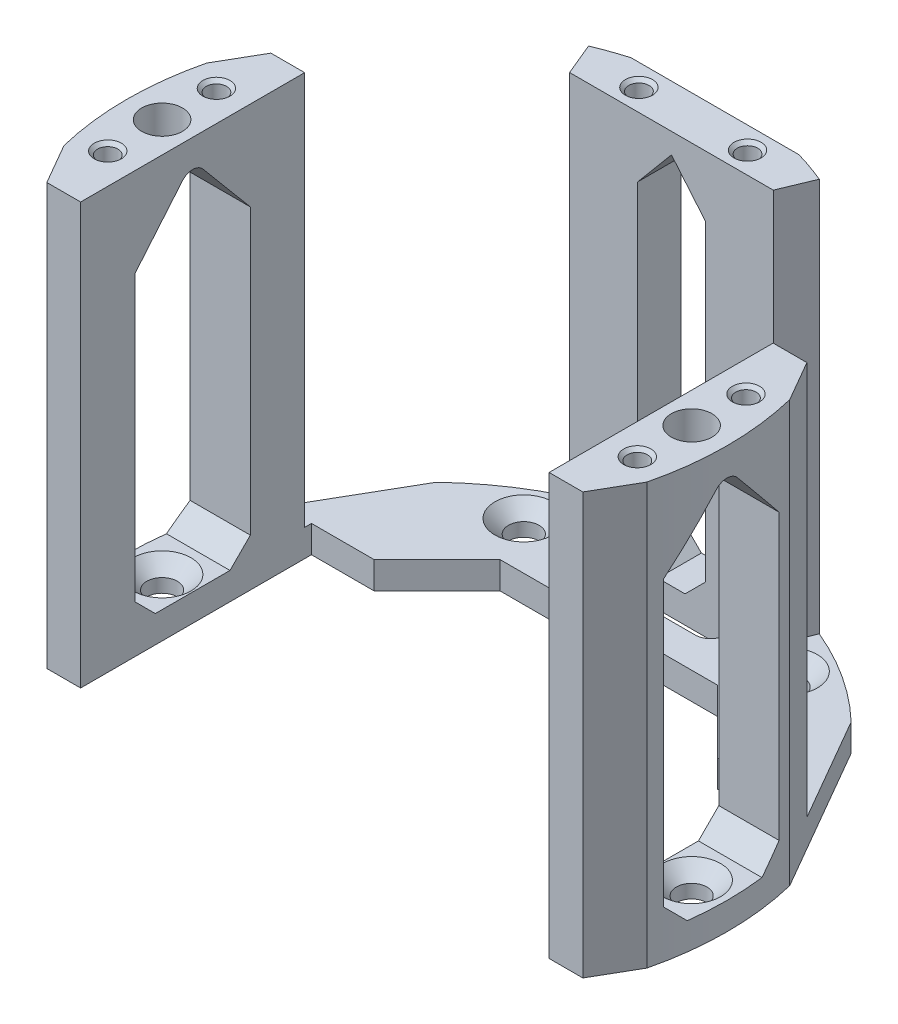
from build123d import *

# Parameters (mm, degrees)
SKETCH_1_R           = 2.250000000000002
SKETCH_1_R_2         = 2.2500000000000027
EXTRUDE_1_DEPTH      = 4
EXTRUDE_2_DEPTH      = 58
EXTRUDE_3_REACH      = 110.805
EXTRUDE_3_END_RADIUS = 44.19999999999999
CUT_EXTRUDE_1_REACH  = 89.17
SKETCH_4_R           = 3.0000000000000013
FILLET_1_R           = 2
CHAMFER_1_SIZE       = 2
EXTRUDE_4_DEPTH      = 58
EXTRUDE_5_DEPTH      = 6.412205295
SKETCH_8_R           = 1.5000000000000042
SKETCH_8_R_2         = 1.5000000000000009
SKETCH_8_R_3         = 1.500000000000004
SKETCH_8_R_4         = 1.500000000000017
SKETCH_8_R_5         = 1.5000000000000173
CUT_EXTRUDE_2_DEPTH  = 5
CHAMFER_2_SIZE       = 0.5
CHAMFER_3_SIZE       = 3


with BuildPart() as part:
    # Эскиз1 → Бобышка-Вытянуть1 (new body)
    with BuildSketch(Plane(origin=(0, 0, 0), x_dir=(1, 0, 0), z_dir=(0, 1, 0))):
        with BuildLine():
            Line((-42.93077537059159, -10.516107934012744), (-39.47597367549217, -16.5))
            Line((-39.47597367549216, -16.5), (-34.49999999999999, -16.5))
            Line((-34.49999999999999, -16.5), (-34.49999999999999, -3.5000000000000013))
            Line((-34.49999999999999, -3.5000000000000013), (-34.49999999999999, 3.5000000000000013))
            Line((-34.49999999999999, 3.5000000000000018), (-34.49999999999999, 17.5))
            Line((-34.49999999999999, 17.5), (-25.274990747593094, 17.499999999999996))
            Line((-25.274990747593094, 17.499999999999996), (-16, 26.77499074759315))
            Line((-16, 26.77499074759315), (16, 26.77499074759315))
            Line((16, 26.77499074759315), (25.274990747593094, 17.499999999999996))
            Line((25.274990747593094, 17.499999999999996), (34.50000000000001, 17.5))
            Line((34.50000000000001, 17.5), (34.50000000000001, 3.5000000000000013))
            Line((34.50000000000001, 3.5000000000000013), (34.5, -3.5000000000000013))
            Line((34.5, -3.5000000000000018), (34.5, -16.5))
            Line((34.5, -16.5), (39.475973675492156, -16.5))
            Line((39.475973675492156, -16.5), (42.9307753705916, -10.516107934012684))
            ThreePointArc((42.93077537059159, -10.516107934012682), (44.199999999999974, 1.599e-14), (42.93077537059159, 10.516107934012718))
            Line((42.93077537059159, 10.516107934012716), (30.572604305089854, 31.92108810808932))
            ThreePointArc((30.57260430508986, 31.92108810808933), (22.099999999999994, 38.27832284727222), (12.358171065501741, 42.43719604210199))
            Line((12.358171065501741, 42.437196042101974), (-12.358171065501741, 42.437196042101974))
            ThreePointArc((-12.358171065501743, 42.43719604210198), (-22.099999999999994, 38.278322847272186), (-30.572604305089868, 31.921088108089307))
            Line((-30.572604305089865, 31.9210881080893), (-42.930775370591604, 10.5161079340127))
            ThreePointArc((-42.930775370591604, 10.516107934012702), (-44.19999999999999, -1.954e-14), (-42.93077537059159, -10.516107934012746))
        make_face()
        with Locations(Location((-39, 0, 0), (0, 0, 270))):
            Circle(SKETCH_1_R, mode=Mode.SUBTRACT)
        with Locations(Location((39, 0, 0), (0, 0, 270))):
            Circle(SKETCH_1_R, mode=Mode.SUBTRACT)
        with Locations(Location((-19.50000000000016, 33.77499074759302, 0), (0, 0, 270))):
            Circle(SKETCH_1_R_2, mode=Mode.SUBTRACT)
        with BuildLine():
            Line((-8, 36.024990747593144), (8, 36.024990747593144))
            ThreePointArc((8, 36.024990747593144), (10.25, 33.774990747593144), (7.999999999999998, 31.524990747593144))
            Line((7.999999999999998, 31.524990747593144), (-7.999999999999998, 31.524990747593144))
            ThreePointArc((-7.999999999999998, 31.524990747593144), (-10.25, 33.774990747593144), (-8, 36.024990747593144))
        make_face(mode=Mode.SUBTRACT)
        with Locations(Location((19.499999999999925, 33.77499074759315, 0), (0, 0, 270))):
            Circle(SKETCH_1_R_2, mode=Mode.SUBTRACT)
    extrude(amount=EXTRUDE_1_DEPTH)

    # Эскиз2 → Бобышка-Вытянуть2 (add)
    with BuildSketch(Plane(origin=(0, 4, 0), x_dir=(1, 0, 0), z_dir=(0, 1, 0))):
        with BuildLine():
            ThreePointArc((-42.9307753705916, 10.516107934012743), (-43.16465657781108, 9.51064784962775), (-43.37499279538843, 8.50000000000001))
            Line((-43.37499279538844, 8.50000000000001), (-34.499999999999986, 8.500000000000005))
            Line((-34.499999999999986, 8.500000000000005), (-34.49999999999999, 16.5))
            Line((-34.49999999999999, 16.5), (-39.47597367549217, 16.5))
            Line((-39.47597367549217, 16.5), (-42.9307753705916, 10.516107934012743))
        make_face()
        with BuildLine():
            Line((-34.499999999999986, -8.500000000000005), (-43.37499279538844, -8.50000000000001))
            ThreePointArc((-43.37499279538843, -8.50000000000001), (-43.16465657781108, -9.51064784962775), (-42.9307753705916, -10.516107934012743))
            Line((-42.9307753705916, -10.516107934012743), (-39.47597367549217, -16.5))
            Line((-39.47597367549217, -16.5), (-34.49999999999999, -16.5))
            Line((-34.49999999999999, -16.5), (-34.499999999999986, -8.500000000000005))
        make_face()
        with BuildLine():
            Line((34.499999999999986, 8.500000000000005), (43.37499279538844, 8.50000000000001))
            ThreePointArc((43.37499279538845, 8.50000000000001), (43.16465657781109, 9.510647849627738), (42.930775370591604, 10.51610793401272))
            Line((42.930775370591604, 10.516107934012684), (39.475973675492156, 16.5))
            Line((39.475973675492156, 16.5), (34.5, 16.5))
            Line((34.5, 16.5), (34.499999999999986, 8.500000000000005))
        make_face()
        with BuildLine():
            ThreePointArc((42.93077537059162, -10.516107934012688), (43.164656577811115, -9.510647849627723), (43.37499279538845, -8.50000000000001))
            Line((43.37499279538844, -8.50000000000001), (34.499999999999986, -8.500000000000005))
            Line((34.499999999999986, -8.500000000000005), (34.5, -16.5))
            Line((34.5, -16.5), (39.475973675492156, -16.5))
            Line((39.475973675492156, -16.5), (42.930775370591604, -10.516107934012684))
        make_face()
    extrude(amount=EXTRUDE_2_DEPTH)

    # Бобышка-Вытянуть3: up to this cylinder (the profile starts inside it)
    extrude_3_end = Plane(origin=(0, 61.785199, 0), z_dir=(0, -1, 0)) * Cylinder(EXTRUDE_3_END_RADIUS, 311.01, mode=Mode.PRIVATE)
    # Эскиз3 → Бобышка-Вытянуть3 (add, up to the surface)
    with BuildSketch(Plane(origin=(-34.49999999999999, 0, 0), x_dir=(0, 0, -1), z_dir=(1, 0, 0)), mode=Mode.PRIVATE) as extrude_3_sk1:
        Polygon((-8.500000000000007, 62.00000000000001), (8.500000000000005, 62.00000000000001), (8.500000000000005, 48.87009446294909), (0, 59.00000000000001), (-8.500000000000005, 48.87009446294909), align=None)
    extrude_3_tool1 = extrude(extrude_3_sk1.sketch, amount=-EXTRUDE_3_REACH, mode=Mode.PRIVATE) & extrude_3_end
    extrude_3 = extrude_3_tool1.solids().sort_by_distance((-34.5, 61.785199, 0))[0]
    add(extrude_3)

    # Зеркальное отражение1: Бобышка-Вытянуть3 across plane
    add(extrude_3.mirror(Plane(origin=(0, 0, 0), x_dir=(0, 0, 1), z_dir=(1, 0, 0))))

    # Вырез-Вытянуть1: up to this face of the body (flat: up to its plane)
    cut_extrude_1_end = Plane(part.part.faces().sort_by_distance((44.00427315, 4, 0))[0])
    # Эскиз4 → Вырез-Вытянуть1 (cut, up to the picked face)
    with BuildSketch(Plane(origin=(0, 62.00000000000001, 0), x_dir=(1, 0, 0), z_dir=(0, 1, 0)), mode=Mode.PRIVATE) as cut_extrude_1_sk1:
        with Locations(Location((-39, 0, 0), (0, 0, 270))):
            Circle(SKETCH_4_R)
    cut_extrude_1_tool1 = split(extrude(cut_extrude_1_sk1.sketch, amount=-CUT_EXTRUDE_1_REACH, mode=Mode.PRIVATE), bisect_by=cut_extrude_1_end, keep=Keep.BOTH, mode=Mode.PRIVATE)
    # Эскиз4 → Вырез-Вытянуть1 (cut, up to the picked face)
    with BuildSketch(Plane(origin=(0, 62.00000000000001, 0), x_dir=(1, 0, 0), z_dir=(0, 1, 0)), mode=Mode.PRIVATE) as cut_extrude_1_sk2:
        with Locations(Location((39, 0, 0), (0, 0, 270))):
            Circle(SKETCH_4_R)
    cut_extrude_1_tool2 = split(extrude(cut_extrude_1_sk2.sketch, amount=-CUT_EXTRUDE_1_REACH, mode=Mode.PRIVATE), bisect_by=cut_extrude_1_end, keep=Keep.BOTH, mode=Mode.PRIVATE)
    add(cut_extrude_1_tool1.solids().sort_by(Axis((-39, 62, 0), (0, -1, 0)))[0], mode=Mode.SUBTRACT)
    add(cut_extrude_1_tool2.solids().sort_by(Axis((39, 62, 0), (0, -1, 0)))[0], mode=Mode.SUBTRACT)

    # Скругление1
    fillet_1_edges = [part.edges().sort_by_distance(p)[0] for p in [
        (35.249999999999986, 59.00000000000001, 0),
        (43.1, 59.00000000000001, 0),
        (-43.1, 59.00000000000001, 0),
        (-35.249999999999986, 59.00000000000001, 0),
    ]]
    fillet(fillet_1_edges, radius=FILLET_1_R)

    # Фаска1
    chamfer_1_edges = [part.edges().sort_by_distance(p)[0] for p in [
        (-19.50000000000016, 4, -36.02499074759302),
        (19.499999999999925, 4, -36.02499074759315),
        (39, 4, -2.250000000000002),
        (-39, 4, -2.250000000000002),
    ]]
    chamfer(chamfer_1_edges, length=CHAMFER_1_SIZE)

    # Эскиз6 → Бобышка-Вытянуть4 (add)
    with BuildSketch(Plane(origin=(0, 4, 0), x_dir=(1, 0, 0), z_dir=(0, 1, 0))):
        with BuildLine():
            Line((8, 36.024990747593144), (5.000000000000001, 36.024990747593144))
            Line((5.000000000000001, 36.024990747593144), (5, 42.437196042101974))
            Line((5, 42.437196042101974), (12.358171065501741, 42.437196042101974))
            ThreePointArc((12.358171065501741, 42.437196042101974), (14.696759256079767, 41.68507247647332), (16.989949980131733, 40.8041860557544))
            Line((16.989949980131733, 40.8041860557544), (15, 36.02499074759314))
            Line((15, 36.02499074759314), (8, 36.024990747593144))
        make_face()
        with BuildLine():
            Line((-12.358171065501741, 42.437196042101974), (-5, 42.437196042101974))
            Line((-5, 42.437196042101974), (-5.000000000000001, 36.024990747593144))
            Line((-5.000000000000001, 36.024990747593144), (-8, 36.024990747593144))
            Line((-8, 36.024990747593144), (-15, 36.02499074759314))
            Line((-15, 36.02499074759314), (-16.989949980131733, 40.8041860557544))
            ThreePointArc((-16.989949980131733, 40.8041860557544), (-14.696759256079767, 41.685072476473316), (-12.358171065501741, 42.437196042101974))
        make_face()
    extrude(amount=EXTRUDE_4_DEPTH)

    # Эскиз7 → Бобышка-Вытянуть5 (add)
    with BuildSketch(Plane.XY.offset(-36.024990747593144)):
        Polygon((-5.000000000000001, 62.00000000000001), (-5, 53.04123203702888), (0, 59.00000000000001), (5.000000000000003, 53.04123203702888), (5.000000000000001, 62.00000000000001), align=None)
    extrude(amount=-EXTRUDE_5_DEPTH)

    # Эскиз8 → Вырез-Вытянуть2 (cut)
    with BuildSketch(Plane(origin=(0, 62.00000000000001, 0), x_dir=(1, 0, 0), z_dir=(0, 1, 0))):
        with Locations(Location((38.99999999999992, 8, 0), (0, 0, 270))):
            Circle(SKETCH_8_R)
        with Locations(Location((8, 39.23109339484765, 0), (0, 0, 270))):
            Circle(SKETCH_8_R_2)
        with Locations(Location((38.99999999999992, -8, 0), (0, 0, 90))):
            Circle(SKETCH_8_R_3)
        with Locations(Location((-8, 39.23109339484765, 0), (0, 0, 90))):
            Circle(SKETCH_8_R)
        with Locations(Location((-38.999999999999865, -8.000000000000222, 0), (0, 0, 270))):
            Circle(SKETCH_8_R_4)
        with Locations(Location((-38.99999999999998, 7.999999999999556, 0), (0, 0, 90))):
            Circle(SKETCH_8_R_5)
    extrude(amount=-CUT_EXTRUDE_2_DEPTH, mode=Mode.SUBTRACT)

    # Фаска2
    chamfer_2_edges = [part.edges().sort_by_distance(p)[0] for p in [
        (8, 62.00000000000001, -40.73109339484765),
        (40.22474487139151, 62.00000000000001, 7.133974596215554),
        (-8, 62.00000000000001, -37.73109339484764),
        (-39.8660254037844, 62.00000000000001, 9.224744871391763),
        (-38.13397459621573, 62.00000000000001, -9.224744871391302),
        (37.775255128608336, 62.00000000000001, -7.133974596215554),
    ]]
    chamfer(chamfer_2_edges, length=CHAMFER_2_SIZE)

    # Фаска3
    chamfer_3_edges = [part.edges().sort_by_distance(p)[0] for p in [
        (-38.93749639769421, 4, 8.500000000000007),
        (38.93749639769421, 4, -8.500000000000007),
        (38.93749639769421, 4, 8.500000000000009),
        (5, 4, -39.23109339484756),
        (-5, 4, -39.23109339484756),
        (-38.93749639769421, 4, -8.500000000000009),
    ]]
    chamfer(chamfer_3_edges, length=CHAMFER_3_SIZE)


solid = part.part
